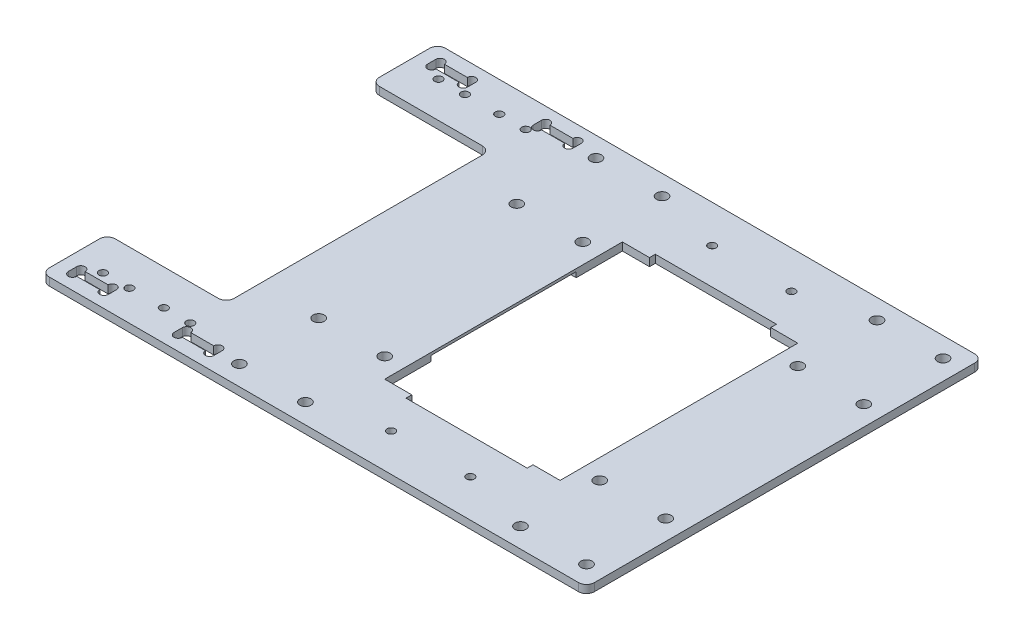
from build123d import *

# Parameters (mm, degrees)
SKETCH_1_W          = 206.4
SKETCH_1_H          = 150
SKETCH_1_R          = 2.1
SKETCH_1_R_2        = 1.5
EXTRUDE_1_DEPTH     = 3
CUT_EXTRUDE_1_DEPTH = 153.892903694
FILLET_1_R          = 3
CUT_EXTRUDE_2_DEPTH = 2
SKETCH_6_R          = 10
CUT_EXTRUDE_3_DEPTH = 10
SKETCH_7_W          = 45
SKETCH_7_H          = 100
CUT_EXTRUDE_4_DEPTH = 10
FILLET_2_R          = 3
SKETCH_8_W          = 45.884132908
SKETCH_8_H          = 94.377965814
CUT_EXTRUDE_5_DEPTH = 10
SKETCH_9_W          = 66.4
SKETCH_9_H          = 90
CUT_EXTRUDE_6_DEPTH = 10
SKETCH_10_R         = 1.5
CUT_EXTRUDE_7_DEPTH = 2


with BuildPart() as part:
    # 草图1 → 凸台-拉伸1 (new body)
    with BuildSketch(Plane(origin=(0, 0, 0), x_dir=(1, 0, 0), z_dir=(0, 1, 0))):
        with Locations((-30, 0)):
            Rectangle(SKETCH_1_W, SKETCH_1_H)
        with Locations(Location((65.7, 67.5, 0), (0, 0, 270))):
            Circle(SKETCH_1_R, mode=Mode.SUBTRACT)
        with Locations(Location((65.7, -67.5, 0), (0, 0, 90))):
            Circle(SKETCH_1_R, mode=Mode.SUBTRACT)
        with Locations(Location((-65.7, -67.5, 0), (0, 0, 270))):
            Circle(SKETCH_1_R, mode=Mode.SUBTRACT)
        with Locations(Location((-65.7, 67.5, 0), (0, 0, 90))):
            Circle(SKETCH_1_R, mode=Mode.SUBTRACT)
        with Locations(Location((-65.7, 37.5, 0), (0, 0, 270))):
            Circle(SKETCH_1_R, mode=Mode.SUBTRACT)
        with Locations(Location((-40.7, 37.5, 0), (0, 0, 270))):
            Circle(SKETCH_1_R, mode=Mode.SUBTRACT)
        with Locations(Location((-40.7, 67.5, 0), (0, 0, 270))):
            Circle(SKETCH_1_R, mode=Mode.SUBTRACT)
        with Locations(Location((-40.7, -67.5, 0), (0, 0, 270))):
            Circle(SKETCH_1_R, mode=Mode.SUBTRACT)
        with Locations(Location((-40.7, -37.5, 0), (0, 0, 270))):
            Circle(SKETCH_1_R, mode=Mode.SUBTRACT)
        with Locations(Location((-65.7, -37.5, 0), (0, 0, 270))):
            Circle(SKETCH_1_R, mode=Mode.SUBTRACT)
        with Locations(Location((40.7, -67.5, 0), (0, 0, 270))):
            Circle(SKETCH_1_R, mode=Mode.SUBTRACT)
        with Locations(Location((40.7, -37.5, 0), (0, 0, 270))):
            Circle(SKETCH_1_R, mode=Mode.SUBTRACT)
        with Locations(Location((65.7, -37.5, 0), (0, 0, 270))):
            Circle(SKETCH_1_R, mode=Mode.SUBTRACT)
        with Locations(Location((65.7, 37.5, 0), (0, 0, 270))):
            Circle(SKETCH_1_R, mode=Mode.SUBTRACT)
        with Locations(Location((40.7, 37.5, 0), (0, 0, 270))):
            Circle(SKETCH_1_R, mode=Mode.SUBTRACT)
        with Locations(Location((40.7, 67.5, 0), (0, 0, 270))):
            Circle(SKETCH_1_R, mode=Mode.SUBTRACT)
        with Locations(Location((-98.4, 63.575, 0), (0, 0, 270))):
            Circle(SKETCH_1_R_2, mode=Mode.SUBTRACT)
        with Locations(Location((-88.4, 63.575, 0), (0, 0, 270))):
            Circle(SKETCH_1_R_2, mode=Mode.SUBTRACT)
        with Locations(Location((-111.4, 63.575, 0), (0, 0, 270))):
            Circle(SKETCH_1_R_2, mode=Mode.SUBTRACT)
        with Locations(Location((-121.4, 63.575, 0), (0, 0, 270))):
            Circle(SKETCH_1_R_2, mode=Mode.SUBTRACT)
        with Locations(Location((-121.4, -63.474999999, 0), (0, 0, 270))):
            Circle(SKETCH_1_R_2, mode=Mode.SUBTRACT)
        with Locations(Location((-111.4, -63.474999999, 0), (0, 0, 270))):
            Circle(SKETCH_1_R_2, mode=Mode.SUBTRACT)
        with Locations(Location((-98.4, -63.425, 0), (0, 0, 270))):
            Circle(SKETCH_1_R_2, mode=Mode.SUBTRACT)
        with Locations(Location((-88.4, -63.425, 0), (0, 0, 270))):
            Circle(SKETCH_1_R_2, mode=Mode.SUBTRACT)
    extrude(amount=EXTRUDE_1_DEPTH)

    # 草图2 → 切除-拉伸1 (cut, through all)
    with BuildSketch(Plane(origin=(0, 0, 0), x_dir=(1, 0, 0), z_dir=(0, 1, 0))):
        with BuildLine():
            Line((-125.2, -66.425), (-116.5, -66.425))
            ThreePointArc((-116.5, -66.425), (-114.9, -64.825), (-113.3, -66.425))
            Line((-113.3, -66.425), (-113.3, -69.575))
            ThreePointArc((-113.3, -69.575), (-114.9, -71.175), (-116.5, -69.575))
            Line((-116.5, -69.575), (-125.2, -69.575))
            ThreePointArc((-125.2, -69.575), (-126.8, -71.175), (-128.4, -69.575))
            Line((-128.4, -69.575), (-128.4, -66.425))
            ThreePointArc((-128.4, -66.425), (-126.8, -64.825), (-125.2, -66.425))
        make_face()
        with BuildLine():
            Line((-85.2, -66.425), (-76.5, -66.425))
            ThreePointArc((-76.5, -66.425), (-74.9, -64.825), (-73.3, -66.425))
            Line((-73.3, -66.425), (-73.3, -69.575))
            ThreePointArc((-73.3, -69.575), (-74.9, -71.175), (-76.5, -69.575))
            Line((-76.5, -69.575), (-85.2, -69.575))
            ThreePointArc((-85.2, -69.575), (-86.8, -71.175), (-88.4, -69.575))
            Line((-88.4, -69.575), (-88.4, -66.425))
            ThreePointArc((-88.4, -66.425), (-86.8, -64.825), (-85.2, -66.425))
        make_face()
        with BuildLine():
            Line((-73.3, 66.425), (-73.3, 69.575))
            ThreePointArc((-73.3, 69.575), (-74.9, 71.175), (-76.5, 69.575))
            Line((-76.5, 69.575), (-85.2, 69.575))
            ThreePointArc((-85.2, 69.575), (-86.8, 71.175), (-88.4, 69.575))
            Line((-88.4, 69.575), (-88.4, 66.425))
            ThreePointArc((-88.4, 66.425), (-86.8, 64.825), (-85.2, 66.425))
            Line((-85.2, 66.425), (-76.5, 66.425))
            ThreePointArc((-76.5, 66.425), (-74.9, 64.825), (-73.3, 66.425))
        make_face()
        with BuildLine():
            Line((-113.3, 66.425), (-113.3, 69.575))
            ThreePointArc((-113.3, 69.575), (-114.9, 71.175), (-116.5, 69.575))
            Line((-116.5, 69.575), (-125.2, 69.575))
            ThreePointArc((-125.2, 69.575), (-126.8, 71.175), (-128.4, 69.575))
            Line((-128.4, 69.575), (-128.4, 66.425))
            ThreePointArc((-128.4, 66.425), (-126.8, 64.825), (-125.2, 66.425))
            Line((-125.2, 66.425), (-116.5, 66.425))
            ThreePointArc((-116.5, 66.425), (-114.9, 64.825), (-113.3, 66.425))
        make_face()
    extrude(amount=CUT_EXTRUDE_1_DEPTH, mode=Mode.SUBTRACT)

    # 圆角1
    fillet_1_edges = [part.edges().sort_by_distance(p)[0] for p in [
        (73.2, 1.5, 75),
        (-133.2, 1.5, 75),
        (-133.2, 1.5, -75),
        (73.2, 1.5, -75),
    ]]
    fillet(fillet_1_edges, radius=FILLET_1_R)

    # 草图4 → 切除-拉伸2 (cut)
    with BuildSketch(Plane(origin=(0, 0, 0), x_dir=(1, 0, 0), z_dir=(0, 1, 0))):
        with BuildLine():
            Line((-120.7, -27.5), (60.7, -27.5))
            ThreePointArc((60.7, -27.5), (64.235533906, -26.035533906), (65.7, -22.5))
            Line((65.7, -22.5), (65.7, 22.5))
            ThreePointArc((65.7, 22.5), (64.235533906, 26.035533906), (60.7, 27.5))
            Line((60.7, 27.5), (-120.7, 27.5))
            ThreePointArc((-120.7, 27.5), (-124.235533906, 26.035533906), (-125.7, 22.5))
            Line((-125.7, 22.5), (-125.7, -22.5))
            ThreePointArc((-125.7, -22.5), (-124.235533906, -26.035533906), (-120.7, -27.5))
        make_face()
    extrude(amount=CUT_EXTRUDE_2_DEPTH, mode=Mode.SUBTRACT)

    # 草图6 → 切除-拉伸3 (cut)
    with BuildSketch(Plane(origin=(0, 3, 0), x_dir=(1, 0, 0), z_dir=(0, 1, 0))):
        with Locations(Location((0, 0, 0), (0, 0, 270))):
            Circle(SKETCH_6_R)
    extrude(amount=-CUT_EXTRUDE_3_DEPTH, mode=Mode.SUBTRACT)

    # 草图7 → 切除-拉伸4 (cut)
    with BuildSketch(Plane(origin=(0, 3, 0), x_dir=(1, 0, 0), z_dir=(0, 1, 0))):
        with Locations((-110.7, 0)):
            Rectangle(SKETCH_7_W, SKETCH_7_H)
    extrude(amount=-CUT_EXTRUDE_4_DEPTH, mode=Mode.SUBTRACT)

    # 圆角2
    fillet_2_edges = [part.edges().sort_by_distance(p)[0] for p in [
        (-133.2, 1.5, 50),
        (-133.2, 1.5, -50),
        (-88.2, 1.5, -50),
        (-88.2, 1.5, 50),
    ]]
    fillet(fillet_2_edges, radius=FILLET_2_R)

    # 草图8 → 切除-拉伸5 (cut)
    with BuildSketch(Plane(origin=(0, 3, 0), x_dir=(1, 0, 0), z_dir=(0, 1, 0))):
        Rectangle(SKETCH_8_W, SKETCH_8_H)
    extrude(amount=-CUT_EXTRUDE_5_DEPTH, mode=Mode.SUBTRACT)

    # 草图9 → 切除-拉伸6 (cut)
    with BuildSketch(Plane(origin=(0, 3, 0), x_dir=(1, 0, 0), z_dir=(0, 1, 0))):
        with Locations((-1e-09, 0)):
            Rectangle(SKETCH_9_W, SKETCH_9_H)
    extrude(amount=-CUT_EXTRUDE_6_DEPTH, mode=Mode.SUBTRACT)

    # 草图10 → 切除-拉伸7 (cut)
    with BuildSketch(Plane(origin=(0, 3, 0), x_dir=(1, 0, 0), z_dir=(0, 1, 0))):
        with Locations(Location((-15, 60.780217665, 0), (0, 0, 270))):
            Circle(SKETCH_10_R)
        with Locations(Location((15, 60.780217665, 0), (0, 0, 90))):
            Circle(SKETCH_10_R)
        with Locations(Location((15, -60.780217665, 0), (0, 0, 270))):
            Circle(SKETCH_10_R)
        with Locations(Location((-15, -60.780217665, 0), (0, 0, 90))):
            Circle(SKETCH_10_R)
    extrude(amount=-CUT_EXTRUDE_7_DEPTH, mode=Mode.SUBTRACT)


solid = part.part
